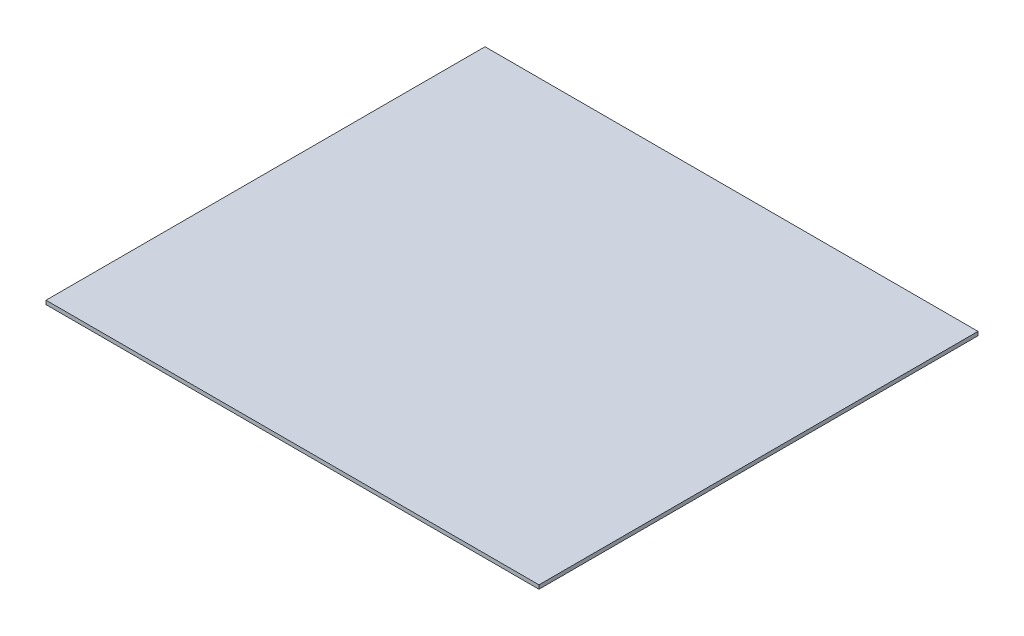
from build123d import *

# Parameters (mm, degrees)
SKETCH1_W           = 128.35
SKETCH1_H           = 114.3
BOSS_EXTRUDE1_DEPTH = 1


with BuildPart() as part:
    # Sketch1 → Boss-Extrude1 (new body)
    with BuildSketch(Plane(origin=(0, 0, 0), x_dir=(1, 0, 0), z_dir=(0, 1, 0))):
        Rectangle(SKETCH1_W, SKETCH1_H)
    extrude(amount=BOSS_EXTRUDE1_DEPTH)


solid = part.part
